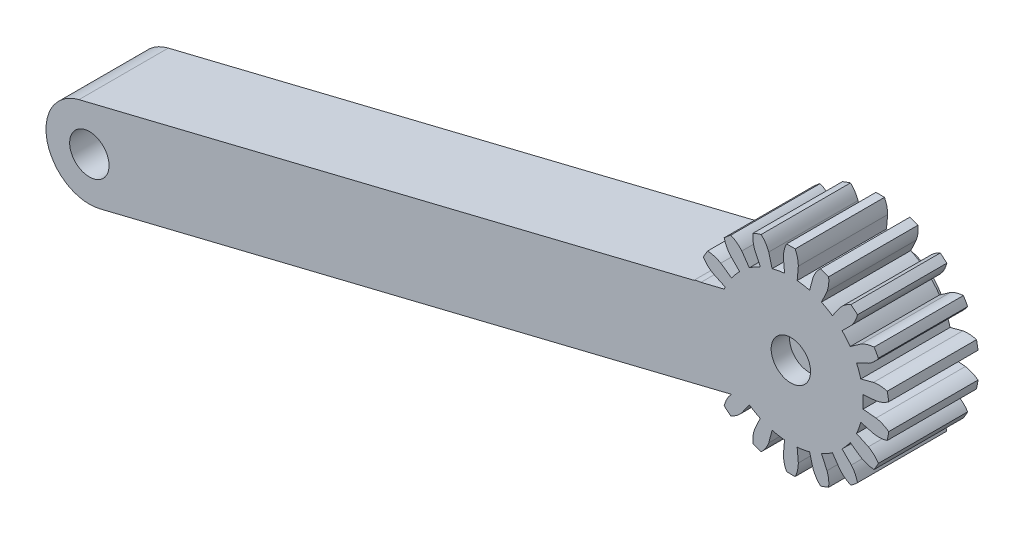
from build123d import *

# Parameters (mm, degrees)
BOSS_EXTRUDE2_DEPTH = 12.7
CIRPATTERN1_COUNT   = 18
CUT_EXTRUDE1_DEPTH  = 7.62
SKETCH5_W           = 2.032
SKETCH5_H           = 5.817262372
SKETCH6_R           = 1.905
CUT_EXTRUDE2_DEPTH  = 3.81
SKETCH7_R           = 1.905
BOSS_EXTRUDE3_DEPTH = 4.318
SKETCH8_R           = 4.40562407
CUT_EXTRUDE3_DEPTH  = 2.032


with BuildPart() as part:
    # Sketch2 → Boss-Extrude2 (new body)
    with BuildSketch(Plane.XY):
        with BuildLine():
            Line((-8.763, -27.305), (-2.184048035, -24.910457312))
            ThreePointArc((-2.184048035, -24.910457312), (-2.085861254, -25.19970624), (-2.000384787, -25.492962715))
            Line((-2.000384787, -25.492962715), (-0.773658987, -25.164262528))
            ThreePointArc((-0.773658987, -25.164262528), (-0.106264973, -25.122191283), (0.552010516, -25.239911886))
            ThreePointArc((0.552010516, -25.239911886), (0.633222569, -25.648192444), (0.696548377, -26.05962683))
            ThreePointArc((0.696548377, -26.05962683), (0.118234575, -26.395391489), (-0.523299868, -26.584119648))
            Line((-0.523299868, -26.584119648), (-1.788467135, -26.694807441))
            ThreePointArc((-1.788467135, -26.694807441), (-1.768489119, -26.99961306), (-1.761825553, -27.305))
            Line((-1.761825553, -27.305), (-8.763, -27.305))
        make_face()
    boss_extrude2 = extrude(amount=BOSS_EXTRUDE2_DEPTH)

    # CirPattern1: Boss-Extrude2 ×18 about axis
    cirpattern1_axis = Axis((-8.763, -27.305, 0), (0, 0, 1))
    for i in range(1, CIRPATTERN1_COUNT):
        add(boss_extrude2.rotate(cirpattern1_axis, i * 360 / CIRPATTERN1_COUNT))

    # Sketch4 → Cut-Extrude1 (cut)
    with BuildSketch(Plane(origin=(0, 0, 0), x_dir=(-1, 0, 0), z_dir=(0, 0, -1))):
        with BuildLine():
            Line((10.2489, -29.2862), (10.2489, -25.3238))
            ThreePointArc((10.2489, -25.3238), (8.763, -24.8285), (7.2771, -25.3238))
            Line((7.2771, -25.3238), (7.2771, -29.2862))
            ThreePointArc((7.2771, -29.2862), (8.763, -29.7815), (10.2489, -29.2862))
        make_face()
    extrude(amount=-CUT_EXTRUDE1_DEPTH, mode=Mode.SUBTRACT)

    # Sketch5 → Cut-Revolve1 (revolve, cut)
    with BuildSketch(Plane.ZY.offset(8.763), mode=Mode.PRIVATE) as cut_revolve1_sk:
        with Locations((1.016, -34.619255256)):
            Rectangle(SKETCH5_W, SKETCH5_H)
        with Locations((11.684, -34.619255256)):
            Rectangle(SKETCH5_W, SKETCH5_H)
    revolve(cut_revolve1_sk.sketch.rotate(Axis((-8.763, -27.305, 7.62), (0, 0, -1)), 270), axis=Axis((-8.763, -27.305, 7.62), (0, 0, -1)), mode=Mode.SUBTRACT)

    # Sketch6 → Cut-Extrude2 (cut)
    with BuildSketch(Plane.XY.offset(12.7)):
        with Locations((-8.763, -27.305)):
            Circle(SKETCH6_R)
    extrude(amount=-CUT_EXTRUDE2_DEPTH, mode=Mode.SUBTRACT)

    # Sketch7 → Boss-Extrude3 (add, symmetric)
    with BuildSketch(Plane(origin=(0, 0, 6.35), x_dir=(-1, 0, 0), z_dir=(0, 0, -1))):
        with BuildLine():
            Line((11.454508553, -23.650525812), (77.596423172, -39.896538245))
            ThreePointArc((77.596423172, -39.896538245), (80.666753219, -44.966255733), (75.597035731, -48.036585779))
            Line((75.597035731, -48.036585779), (9.455121112, -31.790573347))
            ThreePointArc((9.455121112, -31.790573347), (13.203025928, -28.395574968), (11.454508553, -23.650525812))
        make_face()
        with Locations((76.596729452, -43.966562012)):
            Circle(SKETCH7_R, mode=Mode.SUBTRACT)
    extrude(amount=BOSS_EXTRUDE3_DEPTH, both=True)

    # Sketch8 → Cut-Extrude3 (cut)
    with BuildSketch(Plane.XY.offset(10.668)):
        with Locations((-8.763, -27.305)):
            Circle(SKETCH8_R)
    extrude(amount=CUT_EXTRUDE3_DEPTH, mode=Mode.SUBTRACT)


solid = part.part
